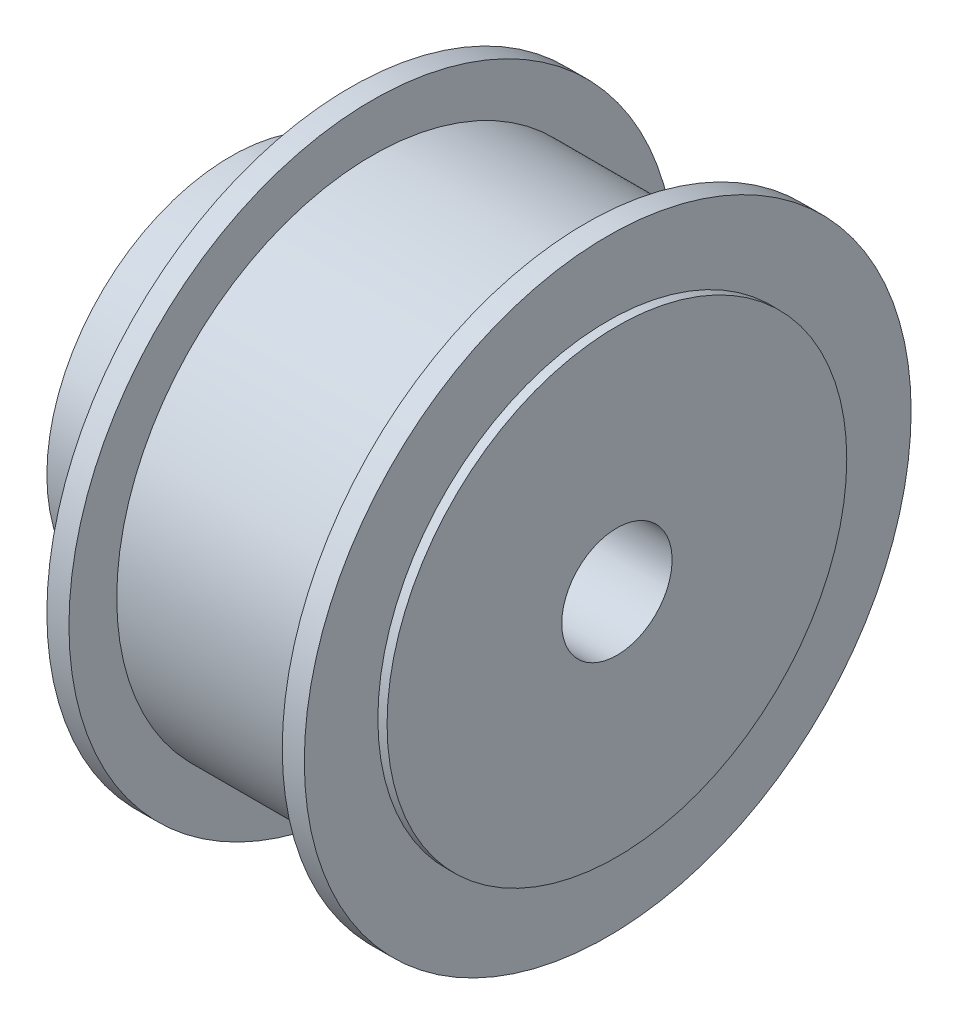
from build123d import *

# Parameters (mm, degrees)
CROQUIS1_R                = 10
SALIENTE_EXTRUIR1_DEPTH   = 6
CROQUIS2_R                = 12.5
SALIENTE_EXTRUIR2_DEPTH   = 0.5
CROQUIS3_R                = 16.5
SALIENTE_EXTRUIR3_DEPTH   = 1.2
CROQUIS4_R                = 13.9
SALIENTE_EXTRUIR4_DEPTH   = 11.6
CROQUIS5_R                = 16.5
SALIENTE_EXTRUIR5_DEPTH   = 1.2
CROQUIS6_R                = 12.5
SALIENTE_EXTRUIR6_DEPTH   = 0.5
CROQUIS7_R                = 3
CORTAR_EXTRUIR1_DEPTH     = 32.392674305
TALADRO_ROSCADO_M41_D     = 3.3
TALADRO_ROSCADO_M41_DEPTH = 11.5
TALADRO_ROSCADO_M41_TIP   = 0.991420021


with BuildPart() as part:
    # Croquis1 → Saliente-Extruir1 (new body)
    with BuildSketch(Plane(origin=(0, 0, 0), x_dir=(0, 0, -1), z_dir=(1, 0, 0))):
        Circle(CROQUIS1_R)
    extrude(amount=SALIENTE_EXTRUIR1_DEPTH)

    # Croquis2 → Saliente-Extruir2 (add)
    with BuildSketch(Plane(origin=(6, 0, 0), x_dir=(0, 0, -1), z_dir=(1, 0, 0))):
        Circle(CROQUIS2_R)
    extrude(amount=SALIENTE_EXTRUIR2_DEPTH)

    # Croquis3 → Saliente-Extruir3 (add)
    with BuildSketch(Plane(origin=(6.5, 0, 0), x_dir=(0, 0, -1), z_dir=(1, 0, 0))):
        Circle(CROQUIS3_R)
    extrude(amount=SALIENTE_EXTRUIR3_DEPTH)

    # Croquis4 → Saliente-Extruir4 (add)
    with BuildSketch(Plane(origin=(7.7, 0, 0), x_dir=(0, 0, -1), z_dir=(1, 0, 0))):
        Circle(CROQUIS4_R)
    extrude(amount=SALIENTE_EXTRUIR4_DEPTH)

    # Croquis5 → Saliente-Extruir5 (add)
    with BuildSketch(Plane(origin=(19.3, 0, 0), x_dir=(0, 0, -1), z_dir=(1, 0, 0))):
        Circle(CROQUIS5_R)
    extrude(amount=SALIENTE_EXTRUIR5_DEPTH)

    # Croquis6 → Saliente-Extruir6 (add)
    with BuildSketch(Plane(origin=(20.5, 0, 0), x_dir=(0, 0, -1), z_dir=(1, 0, 0))):
        Circle(CROQUIS6_R)
    extrude(amount=SALIENTE_EXTRUIR6_DEPTH)

    # Croquis7 → Cortar-Extruir1 (cut, through all)
    with BuildSketch(Plane.ZY):
        Circle(CROQUIS7_R)
    extrude(amount=-CORTAR_EXTRUIR1_DEPTH, mode=Mode.SUBTRACT)

    # Taladro roscado M41
    with Locations(Plane(origin=(0, 0, -10), x_dir=(-1, 0, 0), z_dir=(0, 0, -1))):
        with Locations((-3, 0)):
            Hole(TALADRO_ROSCADO_M41_D / 2, depth=TALADRO_ROSCADO_M41_DEPTH)
            with Locations((0, 0, -(TALADRO_ROSCADO_M41_DEPTH + TALADRO_ROSCADO_M41_TIP / 2))):  # 118° drill point
                Cone(0, TALADRO_ROSCADO_M41_D / 2, TALADRO_ROSCADO_M41_TIP, mode=Mode.SUBTRACT)


solid = part.part
